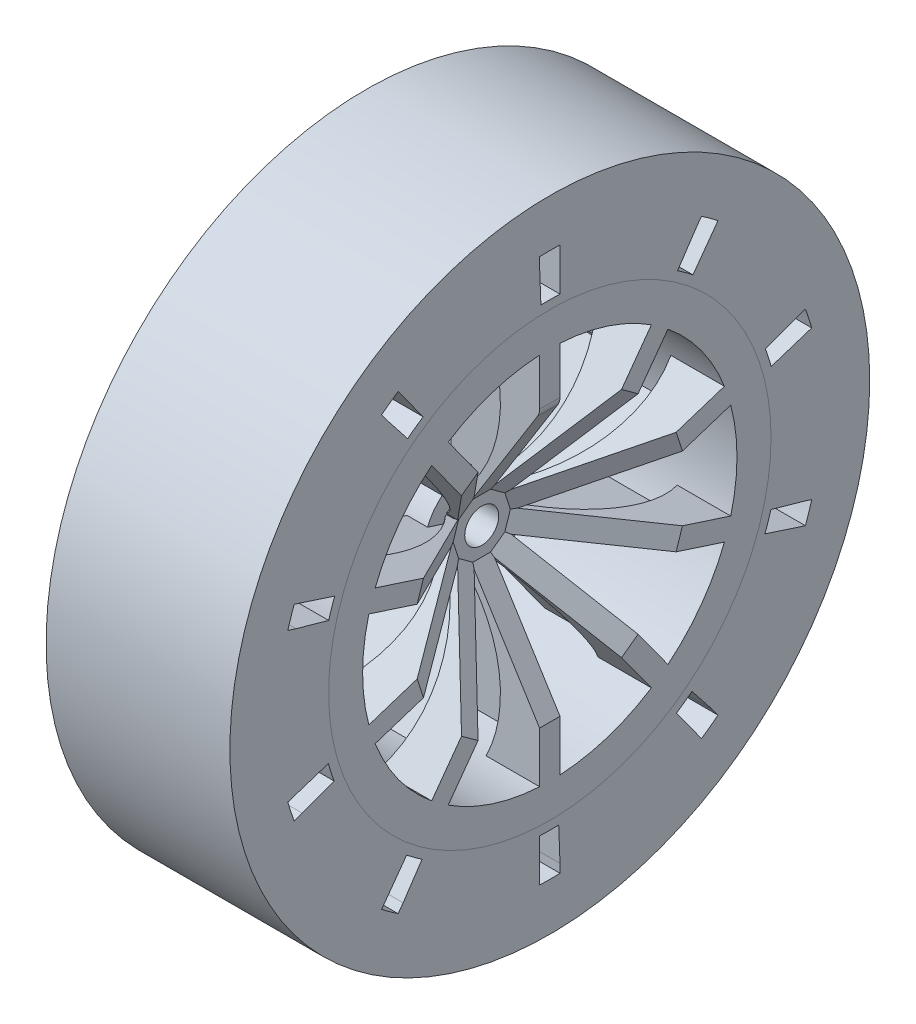
from build123d import *

# Parameters (mm, degrees)
SKETCH_1_R               = 32.5
SKETCH_1_R_2             = 27.5
EXTRUDE_1_DEPTH          = 27
EXTRUDE_2_DEPTH          = 1.5
EXTRUDE_5_DEPTH          = 0.5
FILLET_2_R               = 2
PATTERN_CIRCULAR_1_COUNT = 10
EXTRUDE_START            = -10
SKETCH_3_R               = 5
EXTRUDE_3_DEPTH          = 10
SKETCH_4_R               = 47
SKETCH_4_R_2             = 32.5
EXTRUDE_4_DEPTH          = 27
SKETCH_6_R               = 7.5
EXTRUDE_6_DEPTH          = 9
CUT_EXTRUDE_2_DEPTH      = 6
SKETCH_8_R               = 2.5
CUT_EXTRUDE_3_DEPTH      = 6
CUT_EXTRUDE_4_DEPTH      = 10
PATTERN_CIRCULAR_2_COUNT = 10
MIRROR_1_COPY_1_DEPTH    = 10
MIRROR_1_COPY_2_DEPTH    = 10
MIRROR_1_COPY_3_DEPTH    = 10
MIRROR_1_COPY_4_DEPTH    = 10
MIRROR_1_COPY_5_DEPTH    = 10
MIRROR_1_COPY_6_DEPTH    = 10
MIRROR_1_COPY_7_DEPTH    = 10
MIRROR_1_COPY_8_DEPTH    = 10
MIRROR_1_COPY_9_DEPTH    = 10


with BuildPart() as part:
    # 草图1 → 凸台-拉伸1 (new body)
    with BuildSketch(Plane(origin=(0, 0, 0), x_dir=(0, 0, -1), z_dir=(1, 0, 0))):
        Circle(SKETCH_1_R)
        Circle(SKETCH_1_R_2, mode=Mode.SUBTRACT)
    extrude(amount=EXTRUDE_1_DEPTH)

    # 草图2 → 凸台-拉伸2 (add, symmetric)
    with BuildSketch(Plane.XY):
        with BuildLine():
            Line((27, 27.5), (27, 20))
            Line((27, 20), (17, 4))
            Line((17, 4), (15, 4))
            ThreePointArc((15, 4), (20.946490725, 15.06882207), (19.117450202, 27.5))
            Line((19.117450202, 27.5), (27, 27.5))
        make_face()
    extrude_2 = extrude(amount=EXTRUDE_2_DEPTH, both=True)

    # 草图5 → 凸台-拉伸5 (add, symmetric)
    with BuildSketch(Plane.XY):
        Polygon((13, 23.23755622), (13, 4), (15.75781445, 4), (19.729996713, 9.240677157), (23.113707529, 17.086963109), (23.113707529, 23.23755622), align=None)
    extrude_5 = extrude(amount=EXTRUDE_5_DEPTH, both=True)

    # 圆角2
    fillet_2_edges = [part.edges().sort_by_distance(p)[0] for p in [
        (27, 20, 0),
    ]]
    fillet(fillet_2_edges, radius=FILLET_2_R)

    # 阵列(圆周)1: 凸台-拉伸2, 凸台-拉伸5 ×10 about axis
    pattern_circular_1_axis = Axis((0, 0, 0), (1, 0, 0))
    add([extrude_2.rotate(pattern_circular_1_axis, i * 360 / PATTERN_CIRCULAR_1_COUNT) for i in range(1, PATTERN_CIRCULAR_1_COUNT)])
    add([extrude_5.rotate(pattern_circular_1_axis, i * 360 / PATTERN_CIRCULAR_1_COUNT) for i in range(1, PATTERN_CIRCULAR_1_COUNT)])

    # 草图3 → 凸台-拉伸3 (add)
    with BuildSketch(Plane(origin=(27, 0, 0), x_dir=(0, 0, -1), z_dir=(1, 0, 0)).offset(EXTRUDE_START)):
        Circle(SKETCH_3_R)
    extrude(amount=-EXTRUDE_3_DEPTH)

    # 草图6 → 凸台-拉伸6 (add)
    with BuildSketch(Plane.ZY.offset(-7)):
        Circle(SKETCH_6_R)
    extrude(amount=-EXTRUDE_6_DEPTH)

    # 草图7 → 切除-拉伸2 (cut)
    with BuildSketch(Plane.ZY.offset(-7)):
        Polygon((6.92820323, 0), (3.464101615, 6), (-3.464101615, 6), (-6.92820323, 0), (-3.464101615, -6), (3.464101615, -6), align=None)
    extrude(amount=-CUT_EXTRUDE_2_DEPTH, mode=Mode.SUBTRACT)

    # 草图8 → 切除-拉伸3 (cut)
    with BuildSketch(Plane.ZY.offset(-13)):
        Circle(SKETCH_8_R)
    extrude(amount=-CUT_EXTRUDE_3_DEPTH, mode=Mode.SUBTRACT)


with BuildPart() as body_2:
    # 草图4 → 凸台-拉伸4 (new body)
    with BuildSketch(Plane(origin=(27, 0, 0), x_dir=(0, 0, -1), z_dir=(1, 0, 0))):
        Circle(SKETCH_4_R)
        Circle(SKETCH_4_R_2, mode=Mode.SUBTRACT)
    extrude(amount=-EXTRUDE_4_DEPTH)

    # 草图9 → 切除-拉伸4 (cut)
    with BuildSketch(Plane(origin=(27, 0, 0), x_dir=(0, 0, -1), z_dir=(1, 0, 0))):
        with BuildLine():
            ThreePointArc((1.5, 38.720956858), (0, 38.75), (-1.5, 38.720956858))
            Line((-1.5, 38.720956858), (-1.306405694, 33.723519004))
            ThreePointArc((-1.306405694, 33.723519004), (0.09688093, 33.748674699), (1.5, 33.71546277))
            Line((1.5, 33.71546277), (1.5, 38.720956858))
        make_face()
        with BuildLine():
            Line((-1.5, 39.971865105), (-1.5, 38.720956858))
            ThreePointArc((-1.5, 38.720956858), (0, 38.75), (1.5, 38.720956858))
            Line((1.5, 38.720956858), (1.5, 39.971865105))
            ThreePointArc((1.5, 39.971865105), (0, 40), (-1.5, 39.971865105))
        make_face()
    cut_extrude_4 = extrude(amount=-CUT_EXTRUDE_4_DEPTH, mode=Mode.SUBTRACT)

    # 阵列(圆周)2: 切除-拉伸4 ×10 about axis
    pattern_circular_2_axis = Axis((0, 0, 0), (1, 0, 0))
    for i in range(1, PATTERN_CIRCULAR_2_COUNT):
        add(cut_extrude_4.rotate(pattern_circular_2_axis, i * 360 / PATTERN_CIRCULAR_2_COUNT), mode=Mode.SUBTRACT)

    # 镜向1: 切除-拉伸4 across plane
    add(cut_extrude_4.mirror(Plane(origin=(13.5, 0, 0), x_dir=(0, 0, 1), z_dir=(1, 0, 0))), mode=Mode.SUBTRACT)

    # 镜向1 copy 1 sketch → 镜向1 copy 1 (cut)
    with BuildSketch(Plane(origin=(0, 0, 0), x_dir=(0, 0.5877852522924731, -0.8090169943749475), z_dir=(-1, 0, 0))):
        with BuildLine():
            ThreePointArc((1.5, -38.720956858), (0, -38.75), (-1.5, -38.720956858))
            Line((-1.5, -38.720956858), (-1.306405694, -33.723519004))
            ThreePointArc((-1.306405694, -33.723519004), (0.09688093, -33.748674699), (1.5, -33.71546277))
            Line((1.5, -33.71546277), (1.5, -38.720956858))
        make_face()
        with BuildLine():
            Line((-1.5, -39.971865105), (-1.5, -38.720956858))
            ThreePointArc((-1.5, -38.720956858), (0, -38.75), (1.5, -38.720956858))
            Line((1.5, -38.720956858), (1.5, -39.971865105))
            ThreePointArc((1.5, -39.971865105), (0, -40), (-1.5, -39.971865105))
        make_face()
    extrude(amount=-MIRROR_1_COPY_1_DEPTH, mode=Mode.SUBTRACT)

    # 镜向1 copy 2 sketch → 镜向1 copy 2 (cut)
    with BuildSketch(Plane(origin=(0, 0, 0), x_dir=(0, 0.9510565162951535, -0.30901699437494745), z_dir=(-1, 0, 0))):
        with BuildLine():
            ThreePointArc((1.5, -38.720956858), (0, -38.75), (-1.5, -38.720956858))
            Line((-1.5, -38.720956858), (-1.306405694, -33.723519004))
            ThreePointArc((-1.306405694, -33.723519004), (0.09688093, -33.748674699), (1.5, -33.71546277))
            Line((1.5, -33.71546277), (1.5, -38.720956858))
        make_face()
        with BuildLine():
            Line((-1.5, -39.971865105), (-1.5, -38.720956858))
            ThreePointArc((-1.5, -38.720956858), (0, -38.75), (1.5, -38.720956858))
            Line((1.5, -38.720956858), (1.5, -39.971865105))
            ThreePointArc((1.5, -39.971865105), (0, -40), (-1.5, -39.971865105))
        make_face()
    extrude(amount=-MIRROR_1_COPY_2_DEPTH, mode=Mode.SUBTRACT)

    # 镜向1 copy 3 sketch → 镜向1 copy 3 (cut)
    with BuildSketch(Plane(origin=(0, 0, 0), x_dir=(0, 0.9510565162951536, 0.30901699437494734), z_dir=(-1, 0, 0))):
        with BuildLine():
            ThreePointArc((1.5, -38.720956858), (0, -38.75), (-1.5, -38.720956858))
            Line((-1.5, -38.720956858), (-1.306405694, -33.723519004))
            ThreePointArc((-1.306405694, -33.723519004), (0.09688093, -33.748674699), (1.5, -33.71546277))
            Line((1.5, -33.71546277), (1.5, -38.720956858))
        make_face()
        with BuildLine():
            Line((-1.5, -39.971865105), (-1.5, -38.720956858))
            ThreePointArc((-1.5, -38.720956858), (0, -38.75), (1.5, -38.720956858))
            Line((1.5, -38.720956858), (1.5, -39.971865105))
            ThreePointArc((1.5, -39.971865105), (0, -40), (-1.5, -39.971865105))
        make_face()
    extrude(amount=-MIRROR_1_COPY_3_DEPTH, mode=Mode.SUBTRACT)

    # 镜向1 copy 4 sketch → 镜向1 copy 4 (cut)
    with BuildSketch(Plane(origin=(0, 0, 0), x_dir=(0, 0.5877852522924732, 0.8090169943749473), z_dir=(-1, 0, 0))):
        with BuildLine():
            ThreePointArc((1.5, -38.720956858), (0, -38.75), (-1.5, -38.720956858))
            Line((-1.5, -38.720956858), (-1.306405694, -33.723519004))
            ThreePointArc((-1.306405694, -33.723519004), (0.09688093, -33.748674699), (1.5, -33.71546277))
            Line((1.5, -33.71546277), (1.5, -38.720956858))
        make_face()
        with BuildLine():
            Line((-1.5, -39.971865105), (-1.5, -38.720956858))
            ThreePointArc((-1.5, -38.720956858), (0, -38.75), (1.5, -38.720956858))
            Line((1.5, -38.720956858), (1.5, -39.971865105))
            ThreePointArc((1.5, -39.971865105), (0, -40), (-1.5, -39.971865105))
        make_face()
    extrude(amount=-MIRROR_1_COPY_4_DEPTH, mode=Mode.SUBTRACT)

    # 镜向1 copy 5 sketch → 镜向1 copy 5 (cut)
    with BuildSketch(Plane.ZY):
        with BuildLine():
            ThreePointArc((1.5, -38.720956858), (0, -38.75), (-1.5, -38.720956858))
            Line((-1.5, -38.720956858), (-1.306405694, -33.723519004))
            ThreePointArc((-1.306405694, -33.723519004), (0.09688093, -33.748674699), (1.5, -33.71546277))
            Line((1.5, -33.71546277), (1.5, -38.720956858))
        make_face()
        with BuildLine():
            Line((-1.5, -39.971865105), (-1.5, -38.720956858))
            ThreePointArc((-1.5, -38.720956858), (0, -38.75), (1.5, -38.720956858))
            Line((1.5, -38.720956858), (1.5, -39.971865105))
            ThreePointArc((1.5, -39.971865105), (0, -40), (-1.5, -39.971865105))
        make_face()
    extrude(amount=-MIRROR_1_COPY_5_DEPTH, mode=Mode.SUBTRACT)

    # 镜向1 copy 6 sketch → 镜向1 copy 6 (cut)
    with BuildSketch(Plane(origin=(0, 0, 0), x_dir=(0, -0.587785252292473, 0.8090169943749476), z_dir=(-1, 0, 0))):
        with BuildLine():
            ThreePointArc((1.5, -38.720956858), (0, -38.75), (-1.5, -38.720956858))
            Line((-1.5, -38.720956858), (-1.306405694, -33.723519004))
            ThreePointArc((-1.306405694, -33.723519004), (0.09688093, -33.748674699), (1.5, -33.71546277))
            Line((1.5, -33.71546277), (1.5, -38.720956858))
        make_face()
        with BuildLine():
            Line((-1.5, -39.971865105), (-1.5, -38.720956858))
            ThreePointArc((-1.5, -38.720956858), (0, -38.75), (1.5, -38.720956858))
            Line((1.5, -38.720956858), (1.5, -39.971865105))
            ThreePointArc((1.5, -39.971865105), (0, -40), (-1.5, -39.971865105))
        make_face()
    extrude(amount=-MIRROR_1_COPY_6_DEPTH, mode=Mode.SUBTRACT)

    # 镜向1 copy 7 sketch → 镜向1 copy 7 (cut)
    with BuildSketch(Plane(origin=(0, 0, 0), x_dir=(0, -0.9510565162951535, 0.30901699437494756), z_dir=(-1, 0, 0))):
        with BuildLine():
            ThreePointArc((1.5, -38.720956858), (0, -38.75), (-1.5, -38.720956858))
            Line((-1.5, -38.720956858), (-1.306405694, -33.723519004))
            ThreePointArc((-1.306405694, -33.723519004), (0.09688093, -33.748674699), (1.5, -33.71546277))
            Line((1.5, -33.71546277), (1.5, -38.720956858))
        make_face()
        with BuildLine():
            Line((-1.5, -39.971865105), (-1.5, -38.720956858))
            ThreePointArc((-1.5, -38.720956858), (0, -38.75), (1.5, -38.720956858))
            Line((1.5, -38.720956858), (1.5, -39.971865105))
            ThreePointArc((1.5, -39.971865105), (0, -40), (-1.5, -39.971865105))
        make_face()
    extrude(amount=-MIRROR_1_COPY_7_DEPTH, mode=Mode.SUBTRACT)

    # 镜向1 copy 8 sketch → 镜向1 copy 8 (cut)
    with BuildSketch(Plane(origin=(0, 0, 0), x_dir=(0, -0.9510565162951536, -0.30901699437494723), z_dir=(-1, 0, 0))):
        with BuildLine():
            ThreePointArc((1.5, -38.720956858), (0, -38.75), (-1.5, -38.720956858))
            Line((-1.5, -38.720956858), (-1.306405694, -33.723519004))
            ThreePointArc((-1.306405694, -33.723519004), (0.09688093, -33.748674699), (1.5, -33.71546277))
            Line((1.5, -33.71546277), (1.5, -38.720956858))
        make_face()
        with BuildLine():
            Line((-1.5, -39.971865105), (-1.5, -38.720956858))
            ThreePointArc((-1.5, -38.720956858), (0, -38.75), (1.5, -38.720956858))
            Line((1.5, -38.720956858), (1.5, -39.971865105))
            ThreePointArc((1.5, -39.971865105), (0, -40), (-1.5, -39.971865105))
        make_face()
    extrude(amount=-MIRROR_1_COPY_8_DEPTH, mode=Mode.SUBTRACT)

    # 镜向1 copy 9 sketch → 镜向1 copy 9 (cut)
    with BuildSketch(Plane(origin=(0, 0, 0), x_dir=(0, -0.5877852522924734, -0.8090169943749473), z_dir=(-1, 0, 0))):
        with BuildLine():
            ThreePointArc((1.5, -38.720956858), (0, -38.75), (-1.5, -38.720956858))
            Line((-1.5, -38.720956858), (-1.306405694, -33.723519004))
            ThreePointArc((-1.306405694, -33.723519004), (0.09688093, -33.748674699), (1.5, -33.71546277))
            Line((1.5, -33.71546277), (1.5, -38.720956858))
        make_face()
        with BuildLine():
            Line((-1.5, -39.971865105), (-1.5, -38.720956858))
            ThreePointArc((-1.5, -38.720956858), (0, -38.75), (1.5, -38.720956858))
            Line((1.5, -38.720956858), (1.5, -39.971865105))
            ThreePointArc((1.5, -39.971865105), (0, -40), (-1.5, -39.971865105))
        make_face()
    extrude(amount=-MIRROR_1_COPY_9_DEPTH, mode=Mode.SUBTRACT)


solid = Compound([part.part, body_2.part])
